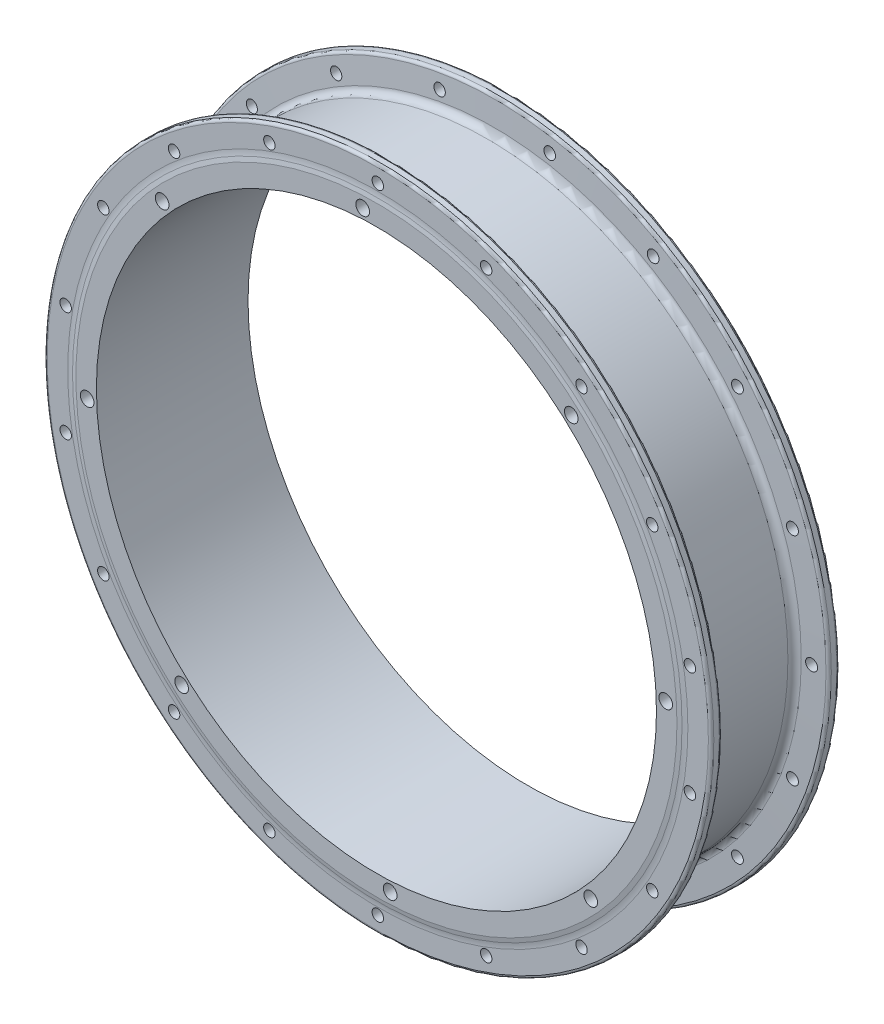
from build123d import *

# Parameters (mm, degrees)
SKETCH_2_R          = 2.1
CUT_EXTRUDE_1_DEPTH = 10
SKETCH_3_R          = 2.1
CUT_EXTRUDE_2_DEPTH = 20
SKETCH_4_R          = 2.5
CUT_EXTRUDE_4_DEPTH = 25
SKETCH_5_R          = 2.5
CUT_EXTRUDE_5_DEPTH = 25
SKETCH_6_R          = 102.5
CUT_EXTRUDE_6_DEPTH = 182.240861973


with BuildPart() as part:
    # Эскиз1 → Повернуть1 (revolve)
    with BuildSketch(Plane(origin=(0, 0, 0), x_dir=(1, 0, 0), z_dir=(0, 1, 0)), mode=Mode.PRIVATE) as revolve_1_sk:
        with BuildLine():
            Line((-110, 24), (-110, 6.889334048))
            ThreePointArc((-110, 6.889334048), (-110.692684022, 5.162021408), (-112.386887166, 4.391894261))
            Line((-112.386887166, 4.391894261), (-121.045245134, 3.999744102))
            ThreePointArc((-121.045245134, 3.999744102), (-121.722926391, 3.691693243), (-122, 3.000768187))
            Line((-122, 3.000768187), (-122, 1))
            ThreePointArc((-122, 1), (-121.707106781, 0.292893219), (-121, 0))
            Line((-121, 0), (-113.5, 0))
            ThreePointArc((-113.5, 0), (-112.520698583, -0.048067086), (-111.550811599, -0.191806253))
            Line((-111.550811599, -0.191806253), (-110, -0.5))
            Line((-110, -0.5), (0, -0.5))
            Line((0, -0.5), (0, 55))
            Line((0, 55), (-110, 55))
            Line((-110, 55), (-110, 50))
            ThreePointArc((-110, 50), (-110.878679656, 47.878679656), (-113, 47))
            Line((-113, 47), (-121, 47))
            ThreePointArc((-121, 47), (-121.707106781, 46.707106781), (-122, 46))
            Line((-122, 46), (-122, 43.999231813))
            ThreePointArc((-122, 43.999231813), (-121.722926391, 43.308306757), (-121.045245134, 43.000255898))
            Line((-121.045245134, 43.000255898), (-112.386887166, 42.608105739))
            ThreePointArc((-112.386887166, 42.608105739), (-110.692684022, 41.837978592), (-110, 40.110665952))
            Line((-110, 40.110665952), (-110, 24))
        make_face()
    revolve(revolve_1_sk.sketch.rotate(Axis((0, 0, 0), (0, 0, -1)), 180), axis=Axis((0, 0, 0), (0, 0, -1)))

    # Эскиз2 → Вырез-Вытянуть1 (cut)
    with BuildSketch(Plane.XY.offset(0.5)):
        with Locations(Location((0, 116, 0), (0, 0, 224.91233598))):
            Circle(SKETCH_2_R)
        with Locations(Location((39.674336626, 109.004344011, 0), (0, 0, 224.937167218))):
            Circle(SKETCH_2_R)
        with Locations(Location((74.563362724, 88.861155402, 0), (0, 0, 224.986060675))):
            Circle(SKETCH_2_R)
        with Locations(Location((100.458946839, 58, 0), (0, 0, 225.04041086))):
            Circle(SKETCH_2_R)
        with Locations(Location((114.237699349, 20.143188609, 0), (0, 0, 225.079053624))):
            Circle(SKETCH_2_R)
        with Locations(Location((114.237699349, -20.143188609, 0), (0, 0, 225.088147157))):
            Circle(SKETCH_2_R)
        with Locations(Location((100.458946839, -58, 0), (0, 0, 225.067214479))):
            Circle(SKETCH_2_R)
        with Locations(Location((74.563362724, -88.861155402, 0), (0, 0, 225.028525595))):
            Circle(SKETCH_2_R)
        with Locations(Location((39.674336626, -109.004344011, 0), (0, 0, 224.990624793))):
            Circle(SKETCH_2_R)
        with Locations(Location((0, -116, 0), (0, 0, 224.969693575))):
            Circle(SKETCH_2_R)
        with Locations(Location((-39.674336626, -109.004344011, 0), (0, 0, 224.972378081))):
            Circle(SKETCH_2_R)
        with Locations(Location((-74.563362724, -88.861155402, 0), (0, 0, 224.993424613))):
            Circle(SKETCH_2_R)
        with Locations(Location((-100.458946839, -58, 0), (0, 0, 225.018648571))):
            Circle(SKETCH_2_R)
        with Locations(Location((-114.237699349, -20.143188609, 0), (0, 0, 225.031856951))):
            Circle(SKETCH_2_R)
        with Locations(Location((-114.237699349, 20.143188609, 0), (0, 0, 225.022654791))):
            Circle(SKETCH_2_R)
        with Locations(Location((-100.458946839, 58, 0), (0, 0, 224.991695436))):
            Circle(SKETCH_2_R)
        with Locations(Location((-74.563362724, 88.861155402, 0), (0, 0, 224.951028341))):
            Circle(SKETCH_2_R)
        with Locations(Location((-39.674336626, 109.004344011, 0), (0, 0, 224.919087449))):
            Circle(SKETCH_2_R)
    extrude(amount=-CUT_EXTRUDE_1_DEPTH, mode=Mode.SUBTRACT)

    # Эскиз3 → Вырез-Вытянуть2 (cut)
    with BuildSketch(Plane(origin=(0, 0, -55), x_dir=(-1, 0, 0), z_dir=(0, 0, -1))):
        with Locations(Location((116, 0, 0), (0, 0, 314.969693575))):
            Circle(SKETCH_3_R)
        with Locations(Location((109.004344011, -39.674336626, 0), (0, 0, 314.972378081))):
            Circle(SKETCH_3_R)
        with Locations(Location((88.861155402, -74.563362724, 0), (0, 0, 314.993424613))):
            Circle(SKETCH_3_R)
        with Locations(Location((58, -100.458946839, 0), (0, 0, 315.018648571))):
            Circle(SKETCH_3_R)
        with Locations(Location((20.143188609, -114.237699349, 0), (0, 0, 315.031856951))):
            Circle(SKETCH_3_R)
        with Locations(Location((-20.143188609, -114.237699349, 0), (0, 0, 315.022654791))):
            Circle(SKETCH_3_R)
        with Locations(Location((-58, -100.458946839, 0), (0, 0, 314.991695436))):
            Circle(SKETCH_3_R)
        with Locations(Location((-88.861155402, -74.563362724, 0), (0, 0, 314.951028341))):
            Circle(SKETCH_3_R)
        with Locations(Location((-109.004344011, -39.674336626, 0), (0, 0, 314.919087449))):
            Circle(SKETCH_3_R)
        with Locations(Location((-116, 0, 0), (0, 0, 180.000000006))):
            Circle(SKETCH_3_R)
        with Locations(Location((-109.004344011, 39.674336626, 0), (0, 0, 314.937167218))):
            Circle(SKETCH_3_R)
        with Locations(Location((-88.861155402, 74.563362724, 0), (0, 0, 314.986060675))):
            Circle(SKETCH_3_R)
        with Locations(Location((-58, 100.458946839, 0), (0, 0, 315.04041086))):
            Circle(SKETCH_3_R)
        with Locations(Location((-20.143188609, 114.237699349, 0), (0, 0, 315.079053624))):
            Circle(SKETCH_3_R)
        with Locations(Location((20.143188609, 114.237699349, 0), (0, 0, 315.088147157))):
            Circle(SKETCH_3_R)
        with Locations(Location((58, 100.458946839, 0), (0, 0, 315.067214479))):
            Circle(SKETCH_3_R)
        with Locations(Location((88.861155402, 74.563362724, 0), (0, 0, 315.028525595))):
            Circle(SKETCH_3_R)
        with Locations(Location((109.004344011, 39.674336626, 0), (0, 0, 314.990624793))):
            Circle(SKETCH_3_R)
    extrude(amount=-CUT_EXTRUDE_2_DEPTH, mode=Mode.SUBTRACT)

    # Эскиз4 → Вырез-Вытянуть4 (cut)
    with BuildSketch(Plane.XY.offset(0.5)):
        with Locations((-5.031575981, 105.880513992)):
            Circle(SKETCH_4_R)
        with Locations((71.310967943, 78.426690935)):
            Circle(SKETCH_4_R)
        with Locations((105.880513992, 5.031575981)):
            Circle(SKETCH_4_R)
        with Locations((78.426690935, -71.310967943)):
            Circle(SKETCH_4_R)
        with Locations((5.031575981, -105.880513992)):
            Circle(SKETCH_4_R)
        with Locations((-71.310967943, -78.426690935)):
            Circle(SKETCH_4_R)
        with Locations((-105.880513992, -5.031575981)):
            Circle(SKETCH_4_R)
        with Locations((-78.426690935, 71.310967943)):
            Circle(SKETCH_4_R)
    extrude(amount=-CUT_EXTRUDE_4_DEPTH, mode=Mode.SUBTRACT)

    # Эскиз5 → Вырез-Вытянуть5 (cut)
    with BuildSketch(Plane(origin=(0, 0, -55), x_dir=(-1, 0, 0), z_dir=(0, 0, -1))):
        with Locations((-16.119277765, 104.767212831)):
            Circle(SKETCH_5_R)
        with Locations((62.683556023, 85.479657254)):
            Circle(SKETCH_5_R)
        with Locations((104.767212831, 16.119277765)):
            Circle(SKETCH_5_R)
        with Locations((85.479657254, -62.683556023)):
            Circle(SKETCH_5_R)
        with Locations((16.119277765, -104.767212831)):
            Circle(SKETCH_5_R)
        with Locations((-62.683556023, -85.479657254)):
            Circle(SKETCH_5_R)
        with Locations((-104.767212831, -16.119277765)):
            Circle(SKETCH_5_R)
        with Locations((-85.479657254, 62.683556023)):
            Circle(SKETCH_5_R)
    extrude(amount=-CUT_EXTRUDE_5_DEPTH, mode=Mode.SUBTRACT)

    # Эскиз6 → Вырез-Вытянуть6 (cut, through all)
    with BuildSketch(Plane(origin=(0, 0, -55), x_dir=(-1, 0, 0), z_dir=(0, 0, -1))):
        Circle(SKETCH_6_R)
    extrude(amount=-CUT_EXTRUDE_6_DEPTH, mode=Mode.SUBTRACT)


solid = part.part
